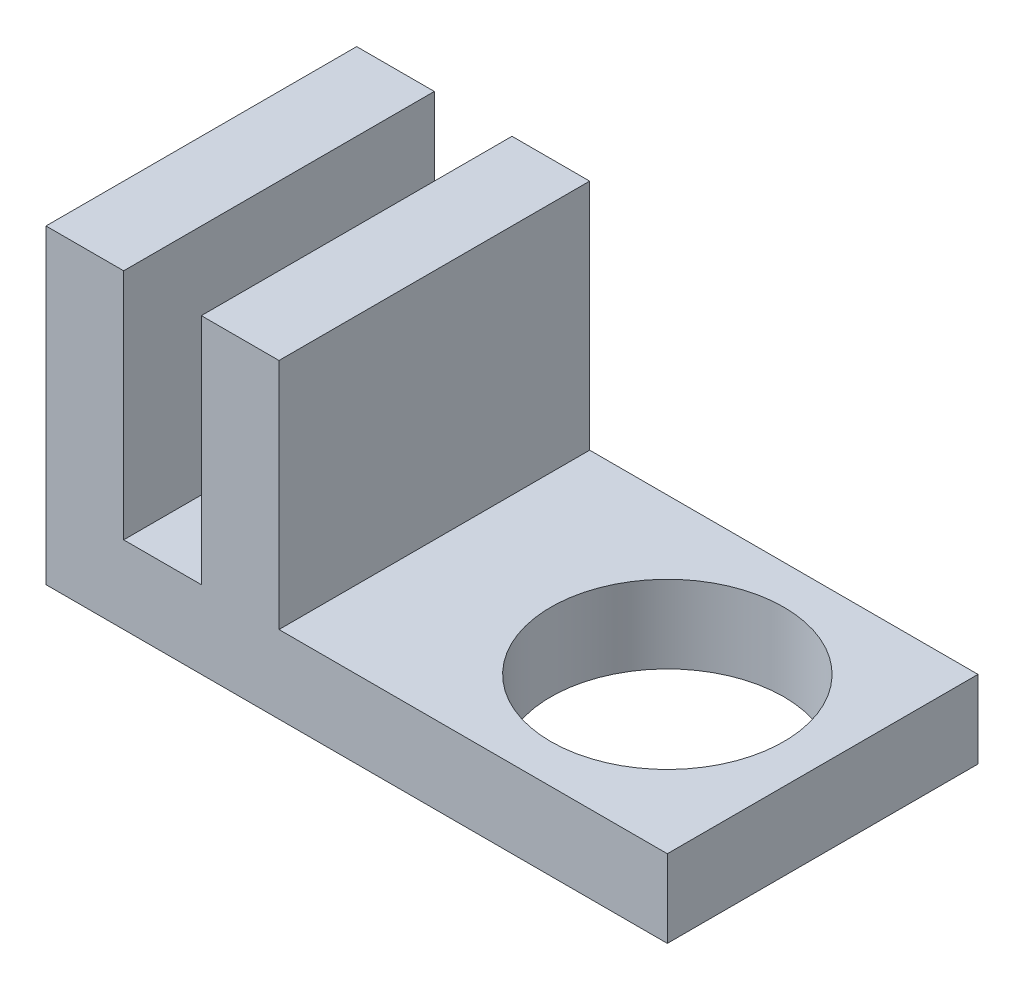
from build123d import *

# Parameters (mm, degrees)
SKETCH1_W             = 10
SKETCH1_H             = 40
BOSS_EXTRUDE1_DEPTH   = 40
BOSS_EXTRUDE1_2_DEPTH = 40
SKETCH1_3_W           = 10
SKETCH1_3_H           = 40
SKETCH1_3_W_2         = 50
SKETCH1_3_R           = 15
BOSS_EXTRUDE2_DEPTH   = 10


with BuildPart() as part:
    # Sketch1 → Boss-Extrude1 (new body)
    with BuildSketch(Plane(origin=(0, 0, 0), x_dir=(1, 0, 0), z_dir=(0, 1, 0))):
        with Locations((5, 20)):
            Rectangle(SKETCH1_W, SKETCH1_H)
    extrude(amount=BOSS_EXTRUDE1_DEPTH)



with BuildPart() as body_2:
    # Sketch1 → Boss-Extrude1 2 (new body)
    with BuildSketch(Plane(origin=(0, 0, 0), x_dir=(1, 0, 0), z_dir=(0, 1, 0))):
        with Locations((25, 20)):
            Rectangle(SKETCH1_W, SKETCH1_H)
    extrude(amount=BOSS_EXTRUDE1_2_DEPTH)


with BuildPart() as part_1:
    add(part.part)

    add(body_2.part)  # Boss-Extrude2 merges body 2
    # Sketch1<3> → Boss-Extrude2 (add)
    # profile 1 of 2: a face of its own
    with BuildSketch(Plane(origin=(0, 0, 0), x_dir=(1, 0, 0), z_dir=(0, 1, 0))):
        with Locations((15, 20)):
            Rectangle(SKETCH1_3_W, SKETCH1_3_H)
    # profile 2 of 2: a face of its own
    with BuildSketch(Plane(origin=(0, 0, 0), x_dir=(1, 0, 0), z_dir=(0, 1, 0))):
        with Locations((55, 20)):
            Rectangle(SKETCH1_3_W_2, SKETCH1_3_H)
        with Locations((60, 20)):
            Circle(SKETCH1_3_R, mode=Mode.SUBTRACT)
    extrude(amount=BOSS_EXTRUDE2_DEPTH)


solid = part_1.part
